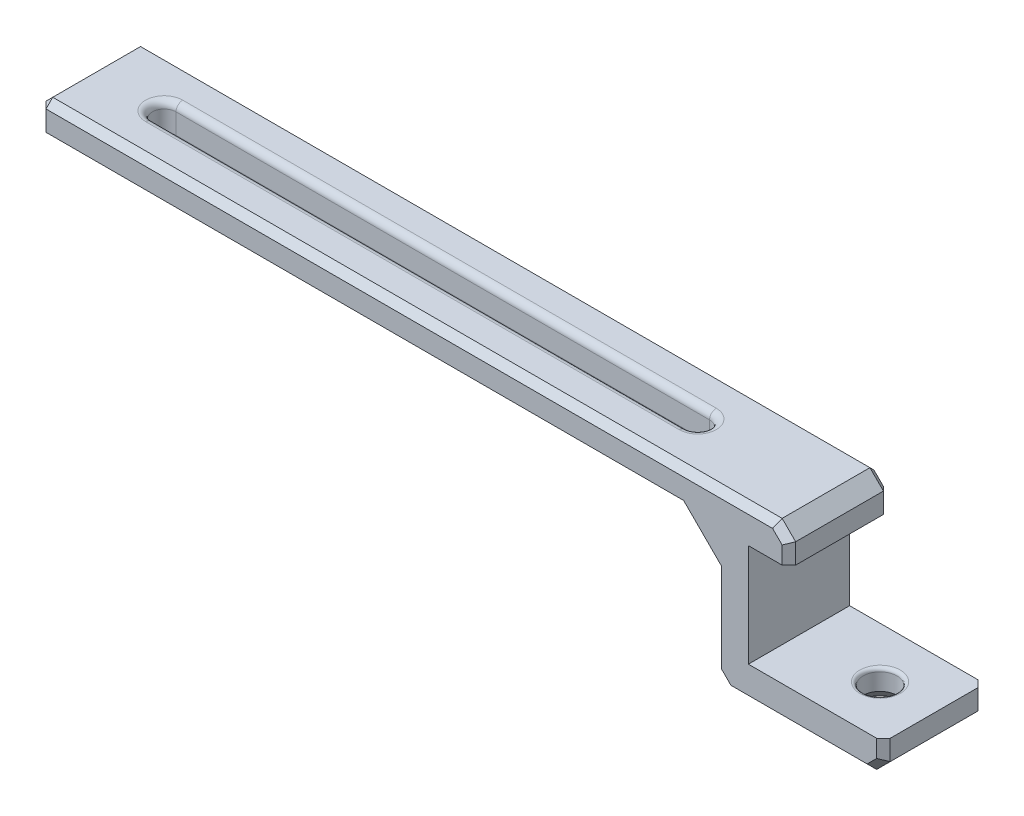
from build123d import *

# Parameters (mm, degrees)
RESSALTO_EXTRUS_O1_DEPTH = 15
ESBO_O3_R                = 2.5
CORTE_EXTRUS_O1_DEPTH    = 15
CHANFRO1_SIZE            = 2
FILETE1_R                = 0.5
CHANFRO5_SIZE            = 2
CHANFRO7_SIZE            = 5
CHANFRO9_SIZE            = 1
CORTE_EXTRUS_O2_DEPTH    = 10
FILETE2_R                = 1


with BuildPart() as part:
    # Esboço1 → Ressalto-extrusão1 (new body)
    with BuildSketch(Plane.XY):
        Polygon((0.299414955, -0.75), (-5.700585045, -0.75), (-5.700585045, -15.95), (14.299414955, -15.95), (14.299414955, -20.95), (-10.700585045, -20.95), (-10.700585045, -0.75), (-110.700585045, -0.75), (-110.700585045, 4.25), (0.299414955, 4.25), align=None)
    extrude(amount=RESSALTO_EXTRUS_O1_DEPTH)

    # Esboço3 → Corte-extrusão1 (cut)
    with BuildSketch(Plane.XZ.offset(20.95)):
        with Locations(Location((6.299414955, 7.5, 0), (0, 0, 270))):
            Circle(ESBO_O3_R)
    extrude(amount=-CORTE_EXTRUS_O1_DEPTH, mode=Mode.SUBTRACT)

    # Chanfro1
    chanfro1_edges = [part.edges().sort_by_distance(p)[0] for p in [
        (6.299414955, -20.95, 10),
    ]]
    chamfer(chanfro1_edges, length=CHANFRO1_SIZE)

    # Filete1
    filete1_edges = [part.edges().sort_by_distance(p)[0] for p in [
        (6.299414955, -15.95, 10),
    ]]
    fillet(filete1_edges, radius=FILETE1_R)

    # Chanfro5
    chanfro5_edges = [part.edges().sort_by_distance(p)[0] for p in [
        (14.299414955, -20.95, 7.5),
        (-10.700585045, -20.95, 7.5),
        (0.299414955, 4.25, 7.5),
    ]]
    chamfer(chanfro5_edges, length=CHANFRO5_SIZE)

    # Chanfro7
    chanfro7_edges = [part.edges().sort_by_distance(p)[0] for p in [
        (-10.700585045, -0.75, 7.5),
    ]]
    chamfer(chanfro7_edges, length=CHANFRO7_SIZE)

    # Chanfro9
    chanfro9_edges = [part.edges().sort_by_distance(p)[0] for p in [
        (13.299414955, -19.95, 0),
        (14.299414955, -17.45, 0),
        (0.299414955, 0.75, 0),
        (-0.700585045, 3.25, 0),
        (-56.200585045, 4.25, 0),
        (-110.700585045, 1.75, 0),
        (-63.200585045, -0.75, 0),
        (-13.200585045, -3.25, 0),
        (-10.700585045, -12.35, 0),
        (-9.700585045, -19.95, 0),
        (1.799414955, -20.95, 0),
        (-110.700585045, 1.75, 15),
        (-56.200585045, 4.25, 15),
        (-0.700585045, 3.25, 15),
        (0.299414955, 0.75, 15),
        (14.299414955, -17.45, 15),
        (13.299414955, -19.95, 15),
        (1.799414955, -20.95, 15),
        (-9.700585045, -19.95, 15),
        (-10.700585045, -12.35, 15),
        (-13.200585045, -3.25, 15),
        (-63.200585045, -0.75, 15),
        (-110.700585045, 4.25, 7.5),
        (-110.700585045, -0.75, 7.5),
    ]]
    chamfer(chanfro9_edges, length=CHANFRO9_SIZE)

    # Esboço4 → Corte-extrusão2 (cut)
    with BuildSketch(Plane.XZ.offset(0.75)):
        with BuildLine():
            Line((-99.700585045, 9.25), (-20.700585045, 9.25))
            ThreePointArc((-20.700585045, 9.25), (-18.950585045, 7.5), (-20.700585045, 5.75))
            Line((-20.700585045, 5.75), (-99.700585045, 5.75))
            ThreePointArc((-99.700585045, 5.75), (-101.450585045, 7.5), (-99.700585045, 9.25))
        make_face()
    extrude(amount=-CORTE_EXTRUS_O2_DEPTH, mode=Mode.SUBTRACT)

    # Filete2
    filete2_edges = [part.edges().sort_by_distance(p)[0] for p in [
        (-101.450585045, 4.25, 7.5),
        (-60.200585045, 4.25, 9.25),
        (-18.950585045, 4.25, 7.5),
        (-60.200585045, 4.25, 5.75),
        (-101.450585045, -0.75, 7.5),
        (-60.200585045, -0.75, 5.75),
        (-18.950585045, -0.75, 7.5),
        (-60.200585045, -0.75, 9.25),
    ]]
    fillet(filete2_edges, radius=FILETE2_R)


solid = part.part
